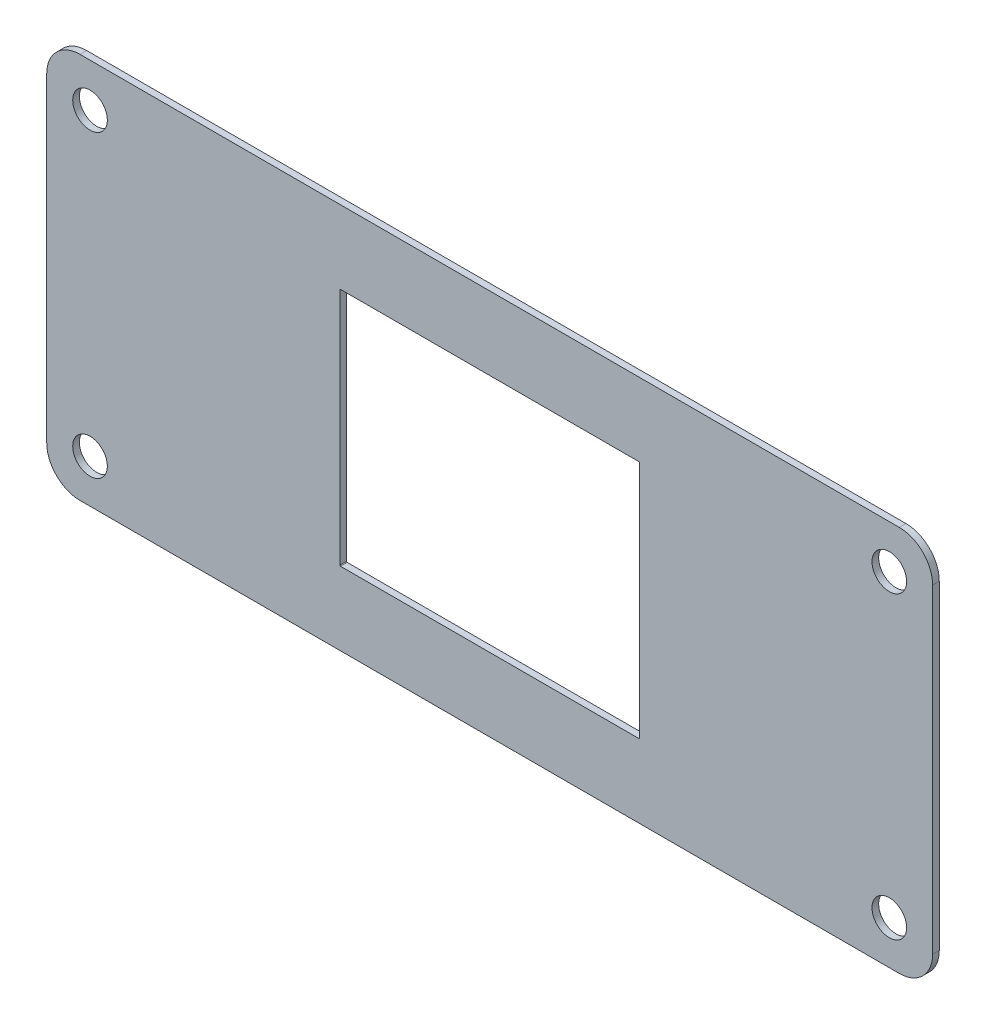
from build123d import *

# Parameters (mm, degrees)
SKETCH1_W           = 133
SKETCH1_H           = 58
BOSS_EXTRUDE1_DEPTH = 1
CUT_EXTRUDE1_REACH  = 74.555
FILLET1_R           = 5
CUT_EXTRUDE2_REACH  = 74.555
SKETCH3_R           = 2.6


with BuildPart() as part:
    # Sketch1 → Boss-Extrude1 (new body)
    with BuildSketch(Plane.XY):
        Rectangle(SKETCH1_W, SKETCH1_H)
    extrude(amount=BOSS_EXTRUDE1_DEPTH)

    # Sketch2 → Cut-Extrude1 (cut, up to next)
    with BuildSketch(Plane.XY, mode=Mode.PRIVATE) as cut_extrude1_sk1:
        with BuildLine():
            Line((-22.4, -18), (22.4, -18))
            ThreePointArc((22.4, -18), (22.470710678, -17.970710678), (22.5, -17.9))
            Line((22.5, -17.9), (22.5, 17.9))
            ThreePointArc((22.5, 17.9), (22.470710678, 17.970710678), (22.4, 18))
            Line((22.4, 18), (-22.4, 18))
            ThreePointArc((-22.4, 18), (-22.470710678, 17.970710678), (-22.5, 17.9))
            Line((-22.5, 17.9), (-22.5, -17.9))
            ThreePointArc((-22.5, -17.9), (-22.470710678, -17.970710678), (-22.4, -18))
        make_face()
    cut_extrude1_tool1 = extrude(cut_extrude1_sk1.sketch, amount=CUT_EXTRUDE1_REACH, mode=Mode.PRIVATE) & part.part
    add(cut_extrude1_tool1.solids().sort_by_distance((0, 0, 0))[0], mode=Mode.SUBTRACT)

    # Fillet1
    fillet1_edges = [part.edges().sort_by_distance(p)[0] for p in [
        (66.5, -29, 0.5),
        (-66.5, -29, 0.5),
        (-66.5, 29, 0.5),
        (66.5, 29, 0.5),
    ]]
    fillet(fillet1_edges, radius=FILLET1_R)

    # Sketch3 → Cut-Extrude2 (cut, up to next)
    with BuildSketch(Plane.XY, mode=Mode.PRIVATE) as cut_extrude2_sk1:
        with Locations(Location((-60, 22.5, 0), (0, 0, 180))):
            Circle(SKETCH3_R)
    cut_extrude2_tool1 = extrude(cut_extrude2_sk1.sketch, amount=CUT_EXTRUDE2_REACH, mode=Mode.PRIVATE) & part.part
    # Sketch3 → Cut-Extrude2 (cut, up to next)
    with BuildSketch(Plane.XY, mode=Mode.PRIVATE) as cut_extrude2_sk2:
        with Locations(Location((60, 22.5, 0), (0, 0, 180))):
            Circle(SKETCH3_R)
    cut_extrude2_tool2 = extrude(cut_extrude2_sk2.sketch, amount=CUT_EXTRUDE2_REACH, mode=Mode.PRIVATE) & part.part
    # Sketch3 → Cut-Extrude2 (cut, up to next)
    with BuildSketch(Plane.XY, mode=Mode.PRIVATE) as cut_extrude2_sk3:
        with Locations(Location((60, -22.5, 0), (0, 0, 180))):
            Circle(SKETCH3_R)
    cut_extrude2_tool3 = extrude(cut_extrude2_sk3.sketch, amount=CUT_EXTRUDE2_REACH, mode=Mode.PRIVATE) & part.part
    # Sketch3 → Cut-Extrude2 (cut, up to next)
    with BuildSketch(Plane.XY, mode=Mode.PRIVATE) as cut_extrude2_sk4:
        with Locations(Location((-60, -22.5, 0), (0, 0, 180))):
            Circle(SKETCH3_R)
    cut_extrude2_tool4 = extrude(cut_extrude2_sk4.sketch, amount=CUT_EXTRUDE2_REACH, mode=Mode.PRIVATE) & part.part
    add(cut_extrude2_tool1.solids().sort_by_distance((-60, 22.5, 0))[0], mode=Mode.SUBTRACT)
    add(cut_extrude2_tool2.solids().sort_by_distance((60, 22.5, 0))[0], mode=Mode.SUBTRACT)
    add(cut_extrude2_tool3.solids().sort_by_distance((60, -22.5, 0))[0], mode=Mode.SUBTRACT)
    add(cut_extrude2_tool4.solids().sort_by_distance((-60, -22.5, 0))[0], mode=Mode.SUBTRACT)


solid = part.part
